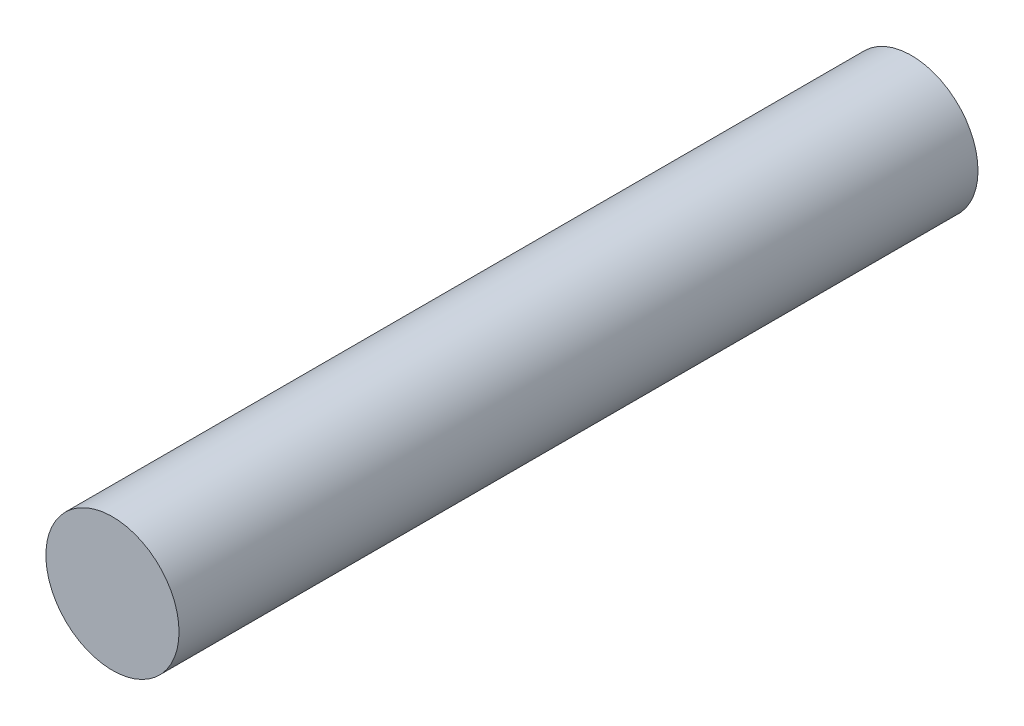
from build123d import *

# Parameters (mm, degrees)
SKETCH1_R           = 2.25
BOSS_EXTRUDE1_DEPTH = 27


with BuildPart() as part:
    # Sketch1 → Boss-Extrude1 (new body)
    with BuildSketch(Plane.XY):
        Circle(SKETCH1_R)
    extrude(amount=BOSS_EXTRUDE1_DEPTH)


solid = part.part
